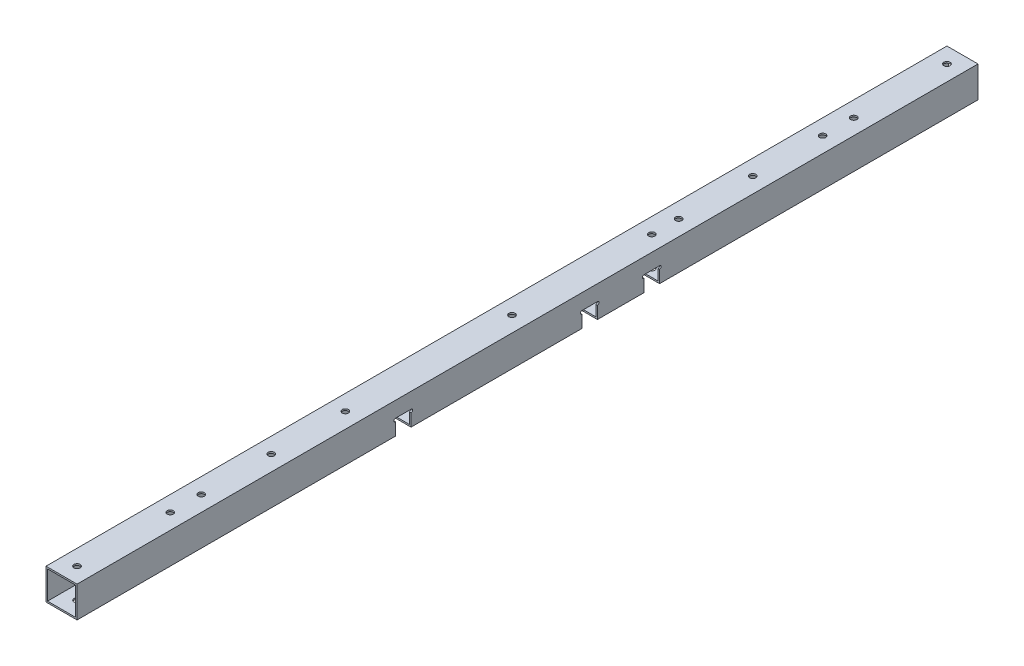
from build123d import *

# Parameters (mm, degrees)
SKETCH_1_W                       = 20
SKETCH_1_H                       = 20
SKETCH_1_W_2                     = 18
SKETCH_1_H_2                     = 18
EXTRUDE_1_DEPTH                  = 290
HOLE_WIZARD_4_0_4_1_D            = 4
HOLE_WIZARD_4_0_4_2_D            = 4
HOLE_WIZARD_4_0_4_3_D            = 4
HOLE_WIZARD_4_0_4_4_D            = 4
HOLE_WIZARD_4_0_4_6_REACH        = 292.861
HOLE_WIZARD_4_0_4_6_BORE_R       = 2
HOLE_WIZARD_13_0_13_1_D          = 13
HOLE_WIZARD_13_0_13_1_DEPTH      = 1.001
SKETCH_14_W                      = 10
SKETCH_14_H                      = 5
CUT_EXTRUDE_1_DEPTH              = 10
SKETCH_17_R                      = 1
CUT_EXTRUDE_3_DEPTH              = 20
PATTERN_LINEAR_1_COUNT           = 2
PATTERN_LINEAR_1_PITCH           = 10
PATTERN_LINEAR_2_COUNT           = 2
PATTERN_LINEAR_2_PITCH           = 40
PATTERN_LINEAR_2_COPY_1_SKETCH_R = 1
PATTERN_LINEAR_2_COPY_1_DEPTH    = 20
PATTERN_LINEAR_3_COUNT           = 2
PATTERN_LINEAR_3_PITCH           = 160
PATTERN_LINEAR_3_COPY_1_SKETCH_R = 1
PATTERN_LINEAR_3_COPY_1_DEPTH    = 20
HOLE_WIZARD_4_0_4_7_D            = 4


with BuildPart() as part:
    # 草图1 → 凸台-拉伸1 (new, symmetric)
    with BuildSketch(Plane.XY):
        Rectangle(SKETCH_1_W, SKETCH_1_H)
        Rectangle(SKETCH_1_W_2, SKETCH_1_H_2, mode=Mode.SUBTRACT)
    extrude(amount=EXTRUDE_1_DEPTH, both=True)

    # Ø4.0 (4) 直径孔1 (through all)
    with Locations(Plane(origin=(0, 10, 0), x_dir=(1, 0, 0), z_dir=(0, 1, 0))):
        with Locations((0, 155)):
            hole_wizard_4_0_4_1 = Hole(HOLE_WIZARD_4_0_4_1_D / 2)

    # 镜向1: Ø4.0 (4) 直径孔1 across plane
    add(hole_wizard_4_0_4_1.mirror(Plane.XY), mode=Mode.SUBTRACT)

    # Ø4.0 (4) 直径孔2 (through all)
    with Locations(Plane(origin=(0, 10, 0), x_dir=(1, 0, 0), z_dir=(0, 1, 0))):
        with Locations((0, 280)):
            hole_wizard_4_0_4_2 = Hole(HOLE_WIZARD_4_0_4_2_D / 2)

    # 镜向2: Ø4.0 (4) 直径孔2 across plane
    add(hole_wizard_4_0_4_2.mirror(Plane.XY), mode=Mode.SUBTRACT)

    # Ø4.0 (4) 直径孔3 (through all)
    with Locations(Plane(origin=(0, -10, 0), x_dir=(-1, 0, 0), z_dir=(0, -1, 0))):
        with Locations((0, 220), (0, 200)):
            hole_wizard_4_0_4_3 = Hole(HOLE_WIZARD_4_0_4_3_D / 2)

    # Ø4.0 (4) 直径孔4 (through all)
    with Locations(Plane(origin=(0, 10, 0), x_dir=(1, 0, 0), z_dir=(0, 1, 0))):
        with Locations((0, 90)):
            Hole(HOLE_WIZARD_4_0_4_4_D / 2)

    # 镜向3: Ø4.0 (4) 直径孔3 across plane
    add(hole_wizard_4_0_4_3.mirror(Plane.XY), mode=Mode.SUBTRACT)

    # Ø4.0 (4) 直径孔6 bore → Ø4.0 (4) 直径孔6 (cut, up to next)
    with BuildSketch(Plane(origin=(0, 10, 0), x_dir=(1, 0, 0), z_dir=(0, 1, 0)), mode=Mode.PRIVATE) as hole_wizard_4_0_4_6_sk1:
        with Locations((0, 107.3)):
            Circle(HOLE_WIZARD_4_0_4_6_BORE_R)
    hole_wizard_4_0_4_6_tool1 = extrude(hole_wizard_4_0_4_6_sk1.sketch, amount=-HOLE_WIZARD_4_0_4_6_REACH, mode=Mode.PRIVATE) & part.part
    hole_wizard_4_0_4_6 = hole_wizard_4_0_4_6_tool1.solids().sort_by_distance((0, 10, -107.3))[0]
    add(hole_wizard_4_0_4_6, mode=Mode.SUBTRACT)

    # 镜向4: Ø4.0 (4) 直径孔6 across plane
    add(hole_wizard_4_0_4_6.mirror(Plane.XY), mode=Mode.SUBTRACT)

    # Ø13.0 (13) 直径孔1
    with Locations(Plane(origin=(0, -9, 0), x_dir=(1, 0, 0), z_dir=(0, 1, 0))):
        with Locations((0, 107.3)):
            hole_wizard_13_0_13_1 = Hole(HOLE_WIZARD_13_0_13_1_D / 2, depth=HOLE_WIZARD_13_0_13_1_DEPTH)

    # 镜向5: Ø13.0 (13) 直径孔1 across plane
    add(hole_wizard_13_0_13_1.mirror(Plane.XY), mode=Mode.SUBTRACT)

    # 草图14 → 切除-拉伸1 (cut)
    with BuildSketch(Plane.XZ.offset(10)):
        with Locations((-5, -82.5)):
            Rectangle(SKETCH_14_W, SKETCH_14_H)
        with Locations((-5, -77.5)):
            Rectangle(SKETCH_14_W, SKETCH_14_H)
        Polygon((0, -80), (0, -85), (10, -85), (10, -75), (0, -75), align=None)
    cut_extrude_1 = extrude(amount=-CUT_EXTRUDE_1_DEPTH, mode=Mode.SUBTRACT)

    # 草图17 → 切除-拉伸3 (cut)
    with BuildSketch(Plane(origin=(10, 0, 0), x_dir=(0, 0, -1), z_dir=(1, 0, 0))):
        with Locations((85, -1)):
            Circle(SKETCH_17_R)
    cut_extrude_3 = extrude(amount=-CUT_EXTRUDE_3_DEPTH, mode=Mode.SUBTRACT)

    # 阵列(线性)1: 切除-拉伸3 ×2
    with Locations(*[(0, 0, i * PATTERN_LINEAR_1_PITCH) for i in range(1, PATTERN_LINEAR_1_COUNT)]):
        add(cut_extrude_3, mode=Mode.SUBTRACT)

    # 阵列(线性)2: 切除-拉伸1, 切除-拉伸3 ×2
    with Locations(*[(0, 0, i * PATTERN_LINEAR_2_PITCH) for i in range(1, PATTERN_LINEAR_2_COUNT)]):
        add(cut_extrude_1, mode=Mode.SUBTRACT)
        add(cut_extrude_3, mode=Mode.SUBTRACT)

    # 阵列(线性)2 copy 1 sketch → 阵列(线性)2 copy 1 (cut)
    with BuildSketch(Plane(origin=(10, 0, 50), x_dir=(0, 0, -1), z_dir=(1, 0, 0))):
        with Locations((85, -1)):
            Circle(PATTERN_LINEAR_2_COPY_1_SKETCH_R)
    extrude(amount=-PATTERN_LINEAR_2_COPY_1_DEPTH, mode=Mode.SUBTRACT)

    # 阵列(线性)3: 切除-拉伸1, 切除-拉伸3 ×2
    with Locations(*[(0, 0, i * PATTERN_LINEAR_3_PITCH) for i in range(1, PATTERN_LINEAR_3_COUNT)]):
        add(cut_extrude_1, mode=Mode.SUBTRACT)
        add(cut_extrude_3, mode=Mode.SUBTRACT)

    # 阵列(线性)3 copy 1 sketch → 阵列(线性)3 copy 1 (cut)
    with BuildSketch(Plane(origin=(10, 0, 170), x_dir=(0, 0, -1), z_dir=(1, 0, 0))):
        with Locations((85, -1)):
            Circle(PATTERN_LINEAR_3_COPY_1_SKETCH_R)
    extrude(amount=-PATTERN_LINEAR_3_COPY_1_DEPTH, mode=Mode.SUBTRACT)

    # Ø4.0 (4) 直径孔7 (through all)
    with Locations(Plane(origin=(0, -10, 0), x_dir=(-1, 0, 0), z_dir=(0, -1, 0))):
        with Locations((0, 0)):
            Hole(HOLE_WIZARD_4_0_4_7_D / 2)


solid = part.part
